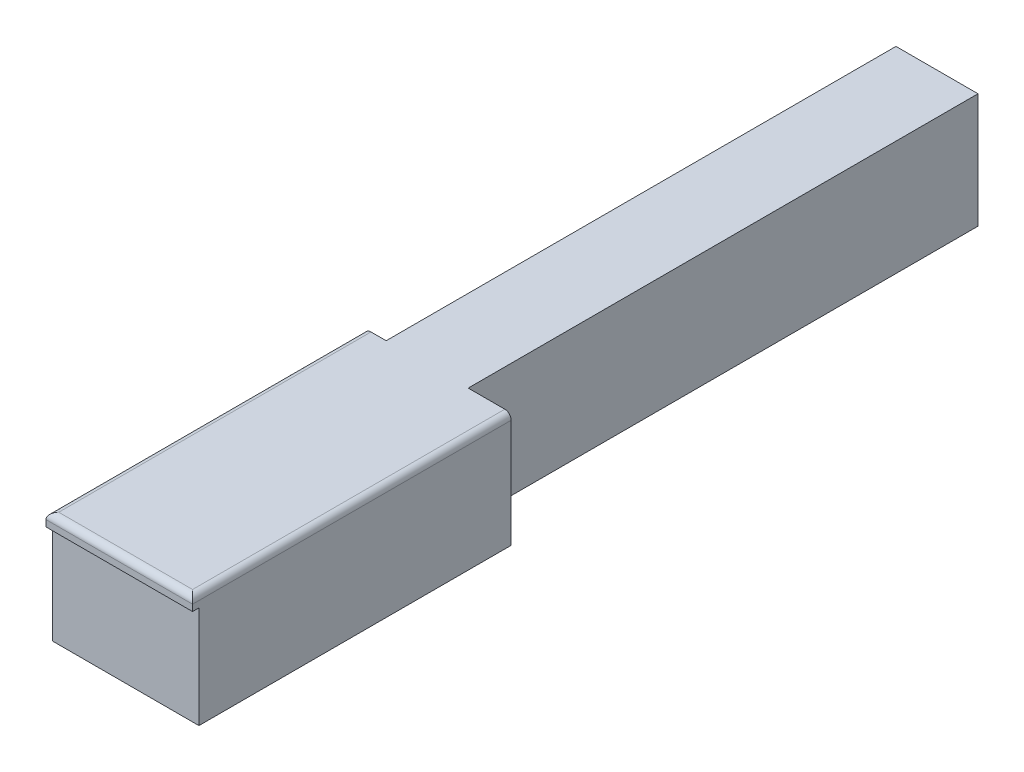
from build123d import *

# Parameters (mm, degrees)
SALIENTE_EXTRUIR1_DEPTH = 18
CROQUIS3_W              = 23
CROQUIS3_H              = 16
CORTAR_EXTRUIR1_DEPTH   = 1
REDONDEO1_R             = 1


with BuildPart() as part:
    # Croquis2 → Saliente-Extruir1 (new body)
    with BuildSketch(Plane(origin=(0, 0, 0), x_dir=(1, 0, 0), z_dir=(0, 1, 0))):
        Polygon((0, 50), (0, 0), (23, 0), (23, 50), (16.255, 50), (16.255, 130), (3.38, 130), (3.38, 50), align=None)
    extrude(amount=SALIENTE_EXTRUIR1_DEPTH)

    # Croquis3 → Cortar-Extruir1 (cut)
    with BuildSketch(Plane.XY):
        with Locations((11.5, 8)):
            Rectangle(CROQUIS3_W, CROQUIS3_H)
    extrude(amount=-CORTAR_EXTRUIR1_DEPTH, mode=Mode.SUBTRACT)

    # Redondeo1
    redondeo1_edges = [part.edges().sort_by_distance(p)[0] for p in [
        (0, 18, -25),
        (11.5, 18, 0),
        (23, 18, -25),
    ]]
    fillet(redondeo1_edges, radius=REDONDEO1_R)


solid = part.part
